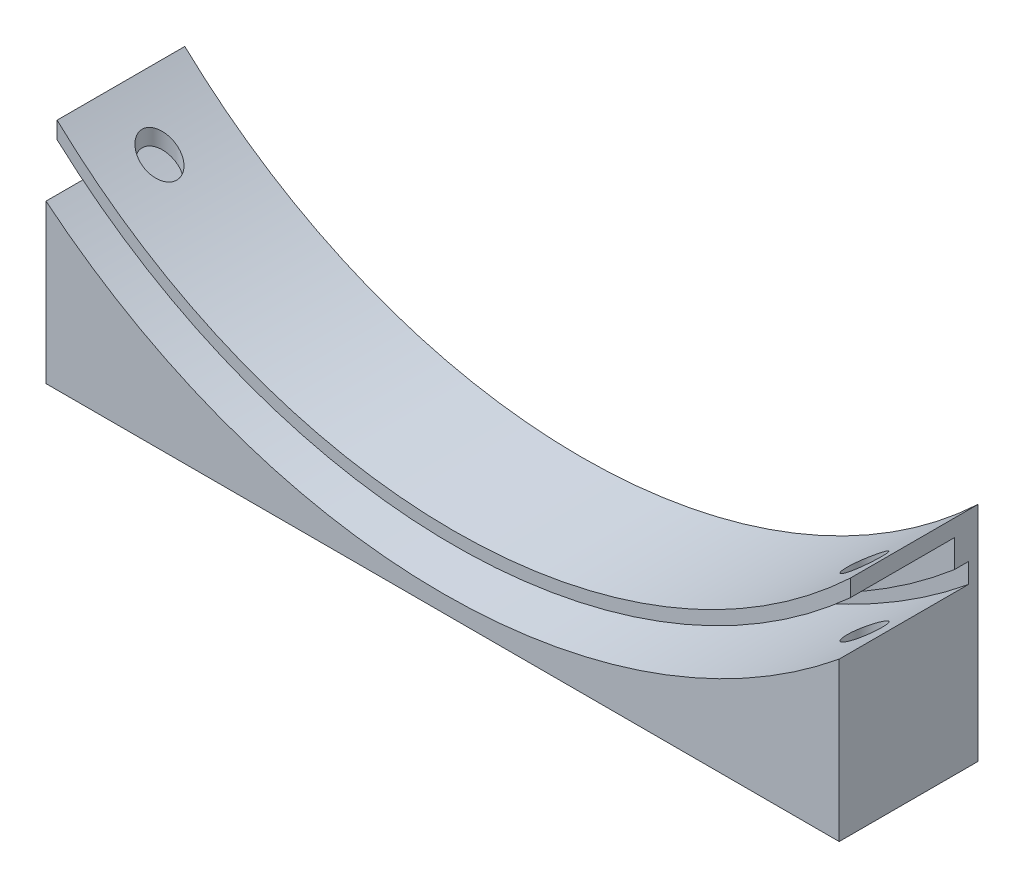
from build123d import *

# Parameters (mm, degrees)
BOSS_EXTRUDE1_DEPTH     = 40
SKETCH2_W               = 26
SKETCH2_H               = 6
CUT_EXTRUDE1_DEPTH      = 243.400412541
CUT_EXTRUDE1_DEPTH_BACK = 243.400412541
SKETCH4_R               = 2.5
CUT_EXTRUDE3_START      = 7.142108
SKETCH7_R               = 5
CUT_EXTRUDE3_DEPTH      = 54.857892


with BuildPart() as part:
    # Sketch1 → Boss-Extrude1 (new body)
    with BuildSketch(Plane.XY):
        with BuildLine():
            Line((0, 0), (228.6, 0))
            Line((228.6, 0), (228.6, 70))
            ThreePointArc((228.6, 70), (114.3, 23.006536612), (0, 70))
            Line((0, 70), (0, 0))
        make_face()
    extrude(amount=BOSS_EXTRUDE1_DEPTH)

    # Sketch2 → Cut-Revolve1 (revolve, cut)
    with BuildSketch(Plane(origin=(114.3, 0, 0), x_dir=(0, 0, -1), z_dir=(1, 0, 0))):
        with Locations((-20, 12.006536612)):
            Rectangle(SKETCH2_W, SKETCH2_H)
    revolve(axis=Axis((114.3, 185.506536612, 40), (0, 0, 1)), mode=Mode.SUBTRACT)

    # Sketch4 → Cut-Extrude1 (cut, two sides: drawn at the far end of the back side and taken through both)
    with BuildSketch(Plane.XZ.offset(-CUT_EXTRUDE1_DEPTH_BACK)):
        with Locations(Location((12.7, 20, 0), (0, 0, 270))):
            Circle(SKETCH4_R)
        with Locations(Location((215.9, 20, 0), (0, 0, 270))):
            Circle(SKETCH4_R)
    extrude(amount=CUT_EXTRUDE1_DEPTH + CUT_EXTRUDE1_DEPTH_BACK, mode=Mode.SUBTRACT)

    # Sketch7 → Cut-Extrude3 (cut)
    with BuildSketch(Plane(origin=(0, 70, 0), x_dir=(-1, 0, 0), z_dir=(0, -1, 0)).offset(CUT_EXTRUDE3_START)):
        with Locations(Location((-215.9, -20, 0), (0, 0, 270))):
            Circle(SKETCH7_R)
        with Locations(Location((-12.7, -20, 0), (0, 0, 270))):
            Circle(SKETCH7_R)
    extrude(amount=CUT_EXTRUDE3_DEPTH, mode=Mode.SUBTRACT)

    # Sketch9 → Cut-Revolve3 (revolve, cut)
    with BuildSketch(Plane(origin=(114.3, 0, 0), x_dir=(0, 0, -1), z_dir=(1, 0, 0))):
        Polygon((0, 18.806536612), (0, 23.006536612), (-40, 23.006536612), (-40, 4.806536612), (-2.8, 4.806536612), (-2.8, 9.206536612), (-6.8, 9.206536612), (-6.8, 15.206536612), (-36.8, 15.206536612), (-36.8, 18.806536612), align=None)
    revolve(axis=Axis((114.3, 185.506536612, 40), (0, 0, 1)), mode=Mode.SUBTRACT)


solid = part.part
